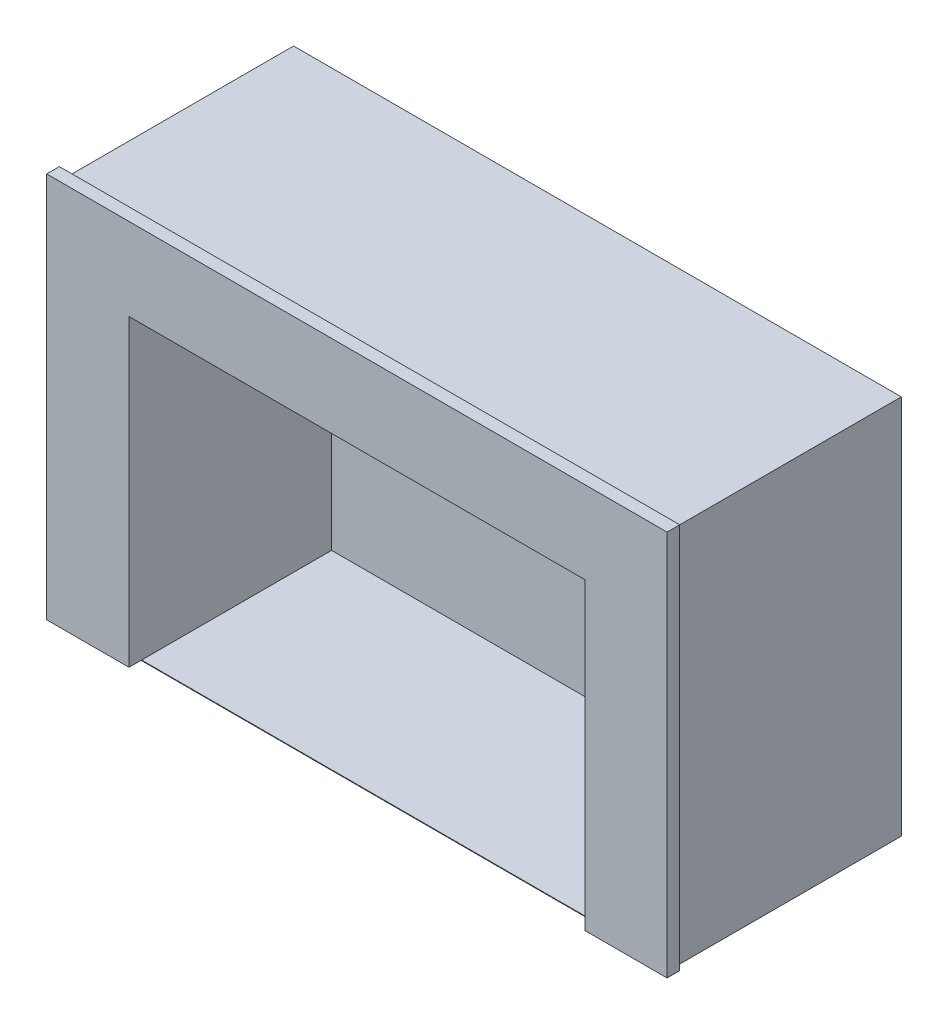
from build123d import *

# Parameters (mm, degrees)
BOSS_EXTRUDE1_DEPTH = 762
SKETCH2_W           = 2438.4
SKETCH2_H           = 1524
BOSS_EXTRUDE2_DEPTH = 152.4
SKETCH3_W           = 2438.4
SKETCH3_H           = 914.4
BOSS_EXTRUDE3_DEPTH = 2.54
BOSS_EXTRUDE4_DEPTH = 50.8


with BuildPart() as part:
    # Sketch1 → Boss-Extrude1 (new body)
    with BuildSketch(Plane.XY):
        Polygon((-1219.2, 0), (-914.4, 0), (-914.4, 1219.2), (914.4, 1219.2), (914.4, 0), (1219.2, 0), (1219.2, 1524), (-1219.2, 1524), align=None)
    extrude(amount=-BOSS_EXTRUDE1_DEPTH)

    # Sketch2 → Boss-Extrude2 (add)
    with BuildSketch(Plane(origin=(0, 0, -762), x_dir=(-1, 0, 0), z_dir=(0, 0, -1))):
        with Locations((0, 762)):
            Rectangle(SKETCH2_W, SKETCH2_H)
    extrude(amount=BOSS_EXTRUDE2_DEPTH)

    # Sketch3 → Boss-Extrude3 (add)
    with BuildSketch(Plane.XZ):
        with Locations((0, -457.2)):
            Rectangle(SKETCH3_W, SKETCH3_H)
    extrude(amount=BOSS_EXTRUDE3_DEPTH)

    # Sketch4 → Boss-Extrude4 (add)
    with BuildSketch(Plane.XY):
        Polygon((-914.4, 0), (-1244.6, 0), (-1244.6, 1549.4), (1244.6, 1549.4), (1244.6, 0), (914.4, 0), (914.4, 1219.2), (-914.4, 1219.2), align=None)
    extrude(amount=BOSS_EXTRUDE4_DEPTH)


solid = part.part
